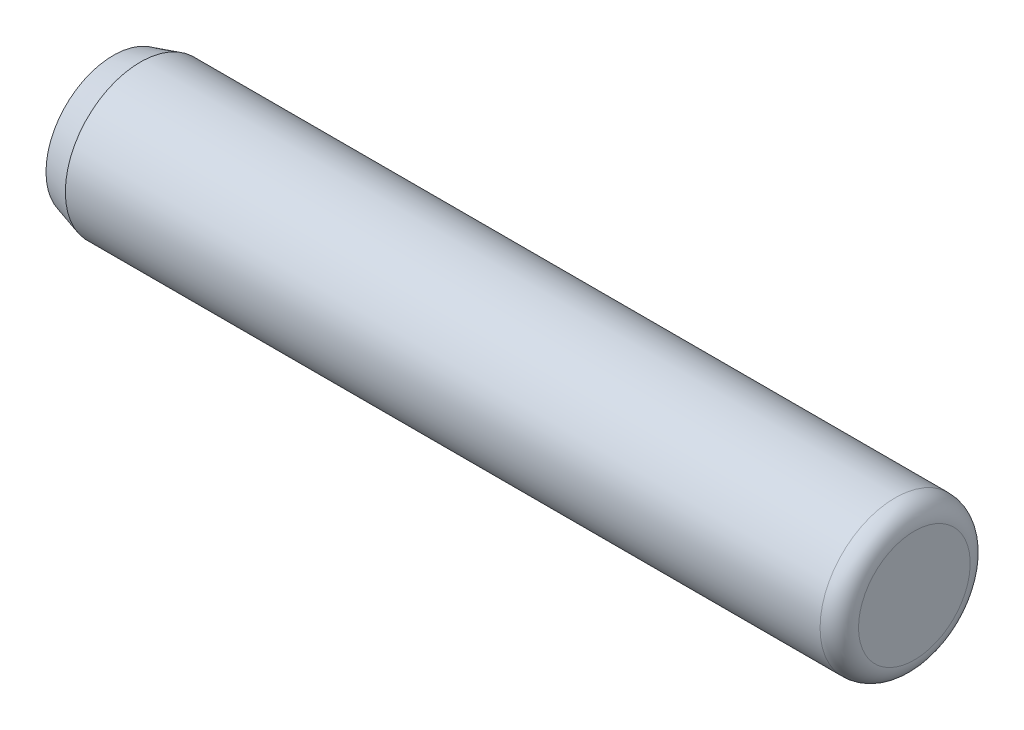
from build123d import *


with BuildPart() as part:
    # Sketch3 → Revolve1 (revolve)
    with BuildSketch(Plane.XY, mode=Mode.PRIVATE) as revolve1_sk:
        with BuildLine():
            Line((6.35, 0.88519), (6.35, 0))
            Line((6.35, 0), (-6.35, 0))
            Line((-6.35, 0), (-6.35, 1.0668))
            Line((-6.35, 1.0668), (-5.920385415, 1.18999))
            Line((-5.920385415, 1.18999), (6.0452, 1.18999))
            ThreePointArc((6.0452, 1.18999), (6.260726147, 1.100716147), (6.35, 0.88519))
        make_face()
    revolve(revolve1_sk.sketch.rotate(Axis((-6.35, 0, 0), (1, 0, 0)), 90), axis=Axis((-6.35, 0, 0), (1, 0, 0)))


solid = part.part
